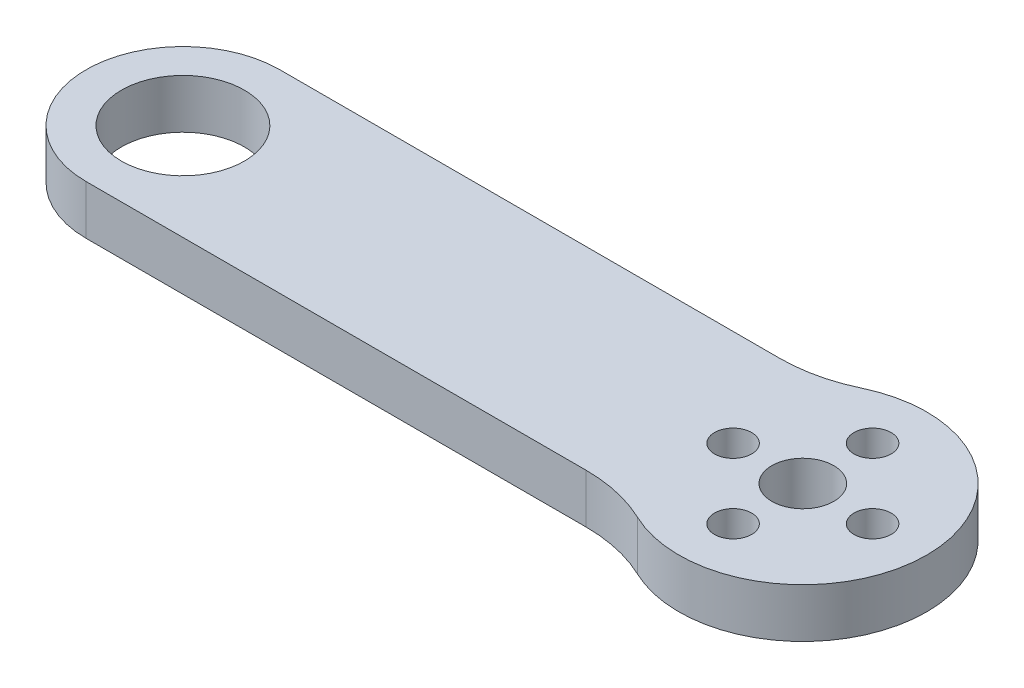
from build123d import *

# Parameters (mm, degrees)
SKETCH1_R            = 3.96875
SKETCH1_R_2          = 2
BOSS_EXTRUDE1_DEPTH  = 3.175
M2_CLEARANCE_HOLE1_D = 2.4


with BuildPart() as part:
    # Sketch1 → Boss-Extrude1 (new body)
    with BuildSketch(Plane(origin=(0, 0, 0), x_dir=(1, 0, 0), z_dir=(0, 1, 0))):
        with BuildLine():
            Line((-7.741931284, 6.25), (-40, 6.25))
            ThreePointArc((-40, 6.25), (-46.25, 0), (-40, -6.25))
            Line((-40, -6.25), (-7.741931284, -6.25))
            ThreePointArc((-7.741931284, -6.25), (-5.537138524, -6.496083408), (-3.440858348, -7.222222222))
            ThreePointArc((-3.440858348, -7.222222222), (8, 0), (-3.440858348, 7.222222222))
            ThreePointArc((-3.440858348, 7.222222222), (-5.537138524, 6.496083408), (-7.741931284, 6.25))
        make_face()
        with Locations(Location((-40, 0, 0), (0, 0, 270))):
            Circle(SKETCH1_R, mode=Mode.SUBTRACT)
        with Locations(Location((0, 0, 0), (0, 0, 270))):
            Circle(SKETCH1_R_2, mode=Mode.SUBTRACT)
    extrude(amount=BOSS_EXTRUDE1_DEPTH)

    # M2 Clearance Hole1 (through all)
    with Locations(Plane(origin=(0, 3.175, 0), x_dir=(1, 0, 0), z_dir=(0, 1, 0))):
        with Locations((-4.5, 0), (0, 4.5), (4.5, 0), (0, -4.5)):
            Hole(M2_CLEARANCE_HOLE1_D / 2)


solid = part.part
